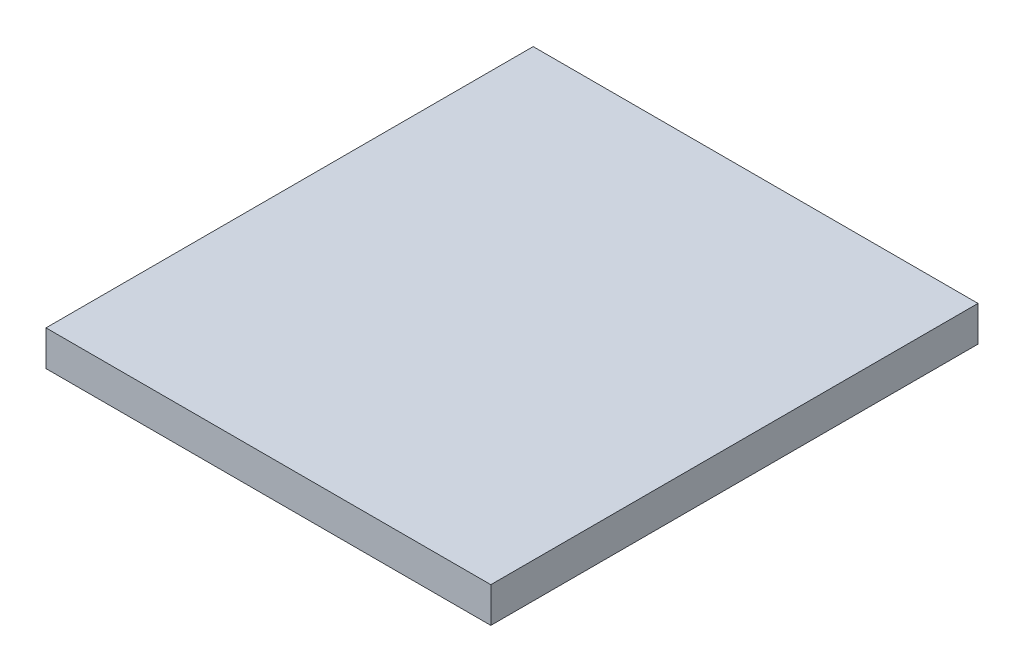
from build123d import *

# Parameters (mm, degrees)
SKETCH1_W           = 63
SKETCH1_H           = 69
BOSS_EXTRUDE1_DEPTH = 5


with BuildPart() as part:
    # Sketch1 → Boss-Extrude1 (new body)
    with BuildSketch(Plane(origin=(0, 0, 0), x_dir=(1, 0, 0), z_dir=(0, 1, 0))):
        Rectangle(SKETCH1_W, SKETCH1_H)
    extrude(amount=BOSS_EXTRUDE1_DEPTH)


solid = part.part
